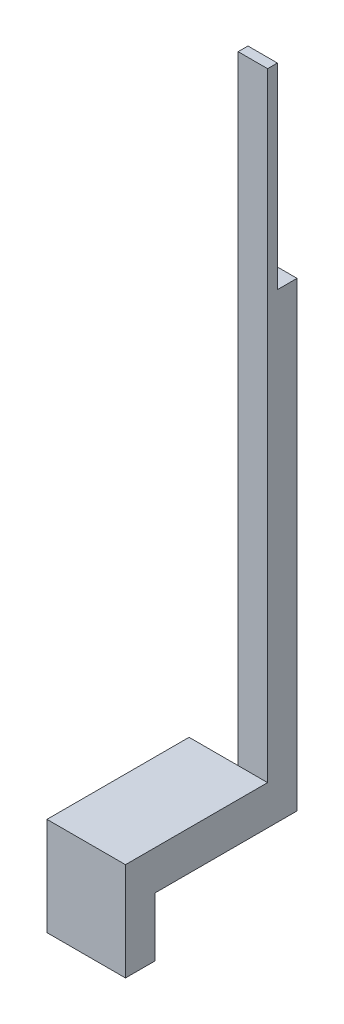
from build123d import *

# Parameters (mm, degrees)
CROQUIS1_W              = 3
CROQUIS1_H              = 47
SALIENTE_EXTRUIR1_DEPTH = 3
CROQUIS2_W              = 3
CROQUIS2_H              = 1
SALIENTE_EXTRUIR2_DEPTH = 20
CROQUIS3_W              = 3
CROQUIS3_H              = 4
SALIENTE_EXTRUIR3_DEPTH = 11.48
CROQUIS4_W              = 3
CROQUIS4_H              = 3
SALIENTE_EXTRUIR4_DEPTH = 10
SALIENTE_EXTRUIR5_DEPTH = 5


with BuildPart() as part:
    # Croquis1 → Saliente-Extruir1 (new body)
    with BuildSketch(Plane.XY):
        with Locations((1.5, 23.5)):
            Rectangle(CROQUIS1_W, CROQUIS1_H)
    extrude(amount=SALIENTE_EXTRUIR1_DEPTH)

    # Croquis2 → Saliente-Extruir2 (add)
    with BuildSketch(Plane(origin=(0, 47, 0), x_dir=(1, 0, 0), z_dir=(0, 1, 0))):
        with Locations((1.5, -2.5)):
            Rectangle(CROQUIS2_W, CROQUIS2_H)
    extrude(amount=SALIENTE_EXTRUIR2_DEPTH)

    # Croquis3 → Saliente-Extruir3 (add)
    with BuildSketch(Plane.XY.offset(3)):
        with Locations((1.5, 2)):
            Rectangle(CROQUIS3_W, CROQUIS3_H)
    extrude(amount=SALIENTE_EXTRUIR3_DEPTH)

    # Croquis4 → Saliente-Extruir4 (add)
    with BuildSketch(Plane(origin=(0, 4, 0), x_dir=(1, 0, 0), z_dir=(0, 1, 0))):
        with Locations((1.5, -15.98)):
            Rectangle(CROQUIS4_W, CROQUIS4_H)
    extrude(amount=-SALIENTE_EXTRUIR4_DEPTH)

    # Croquis5 → Saliente-Extruir5 (add)
    with BuildSketch(Plane.ZY):
        Polygon((14.48, 0), (3, 0), (3, 4), (17.48, 4), (17.48, -6), (14.48, -6), align=None)
    extrude(amount=SALIENTE_EXTRUIR5_DEPTH)


solid = part.part
